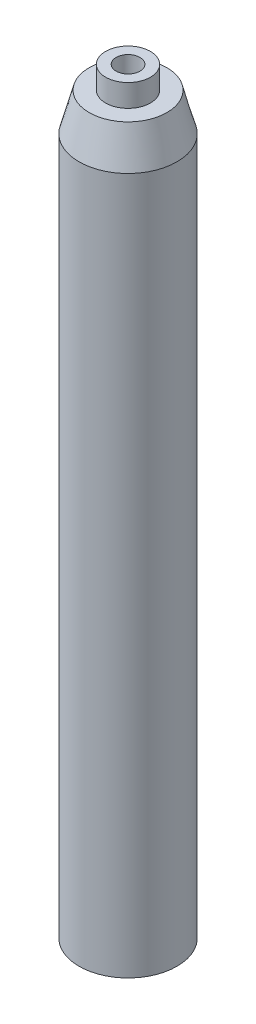
from build123d import *


with BuildPart() as part:
    # 草图1 → 旋转1 (revolve)
    with BuildSketch(Plane.XY):
        Polygon((1.35255, 70.77456), (0, 69.961865969), (0, 15.900294031), (1.35255, 15.0876), (1.35255, 0), (5.556250002, 0), (5.556250002, 79.046265928), (4.41325, 83.312), (2.54, 83.312), (2.54, 85.852), (1.35255, 85.852), align=None)
    revolve(axis=Axis((0, 85.852, 0), (0, -1, 0)))


solid = part.part
